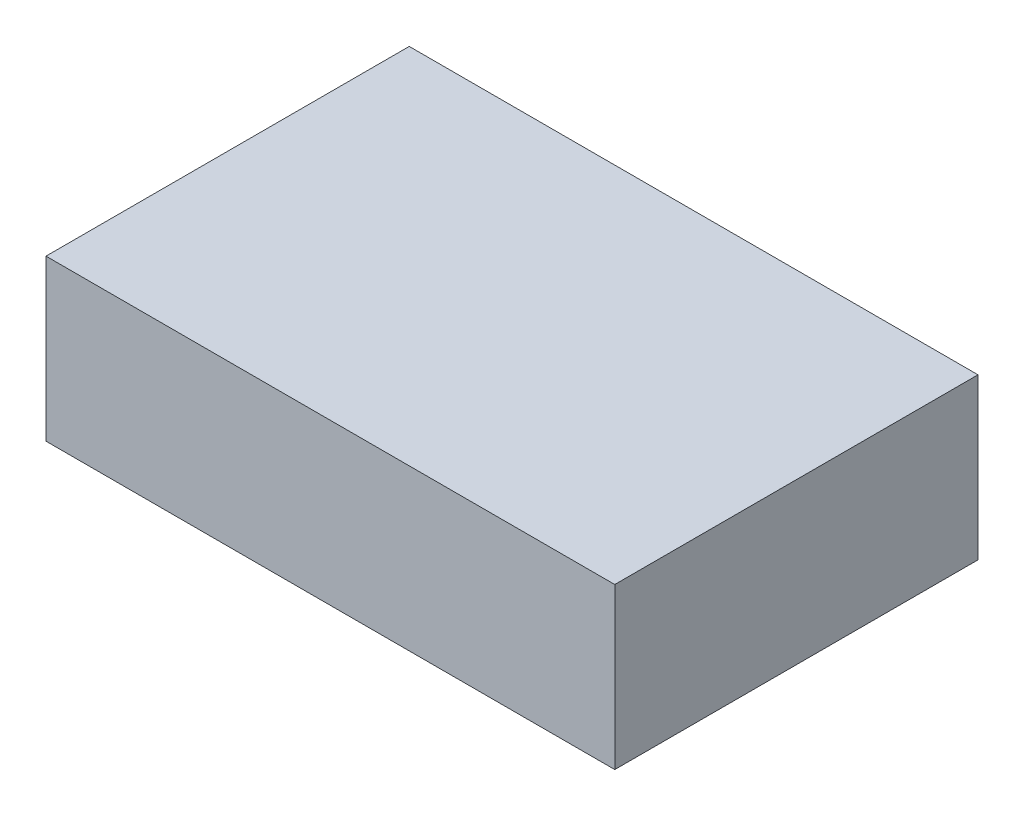
from build123d import *

# Parameters (mm, degrees)
SKICA1_W                = 88
SKICA1_H                = 56.2
P_IDAT_VYSUNUT_M1_DEPTH = 24.8


with BuildPart() as part:
    # Skica1 → Přidat vysunutím1 (new body)
    with BuildSketch(Plane(origin=(0, 0, 0), x_dir=(1, 0, 0), z_dir=(0, 1, 0))):
        with Locations((44, 28.1)):
            Rectangle(SKICA1_W, SKICA1_H)
    extrude(amount=P_IDAT_VYSUNUT_M1_DEPTH)


solid = part.part
